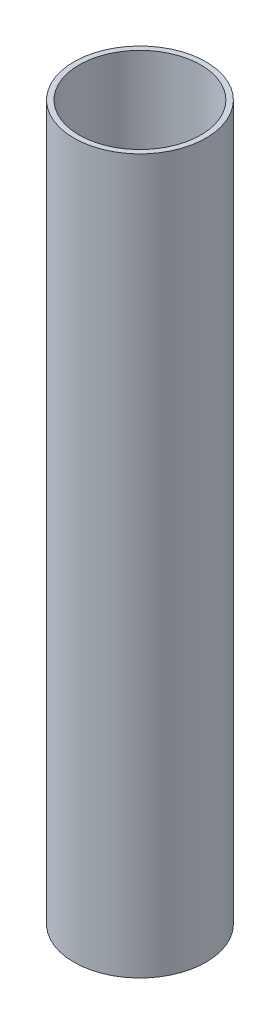
from build123d import *

# Parameters (mm, degrees)
SKETCH_1_R      = 12.5
SKETCH_1_R_2    = 11.5
EXTRUDE_1_DEPTH = 135


with BuildPart() as part:
    # Эскиз1 → Бобышка-Вытянуть1 (new body)
    with BuildSketch(Plane(origin=(0, 0, 0), x_dir=(1, 0, 0), z_dir=(0, 1, 0))):
        with Locations(Location((0, 0, 0), (0, 0, 270))):
            Circle(SKETCH_1_R)
        with Locations(Location((0, 0, 0), (0, 0, 270))):
            Circle(SKETCH_1_R_2, mode=Mode.SUBTRACT)
    extrude(amount=EXTRUDE_1_DEPTH)


solid = part.part
